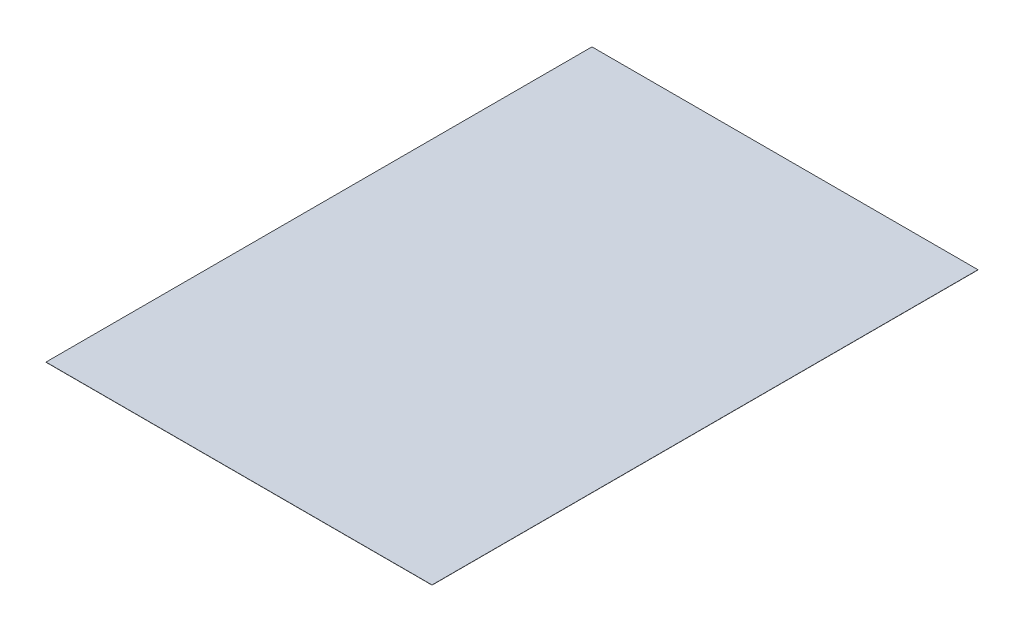
from build123d import *

# Parameters (mm, degrees)
SKETCH1_W           = 210
SKETCH1_H           = 297
BOSS_EXTRUDE1_DEPTH = 0.1


with BuildPart() as part:
    # Sketch1 → Boss-Extrude1 (new body)
    with BuildSketch(Plane(origin=(0, 0, 0), x_dir=(1, 0, 0), z_dir=(0, 1, 0))):
        with Locations((105, 148.5)):
            Rectangle(SKETCH1_W, SKETCH1_H)
    extrude(amount=BOSS_EXTRUDE1_DEPTH)


solid = part.part
